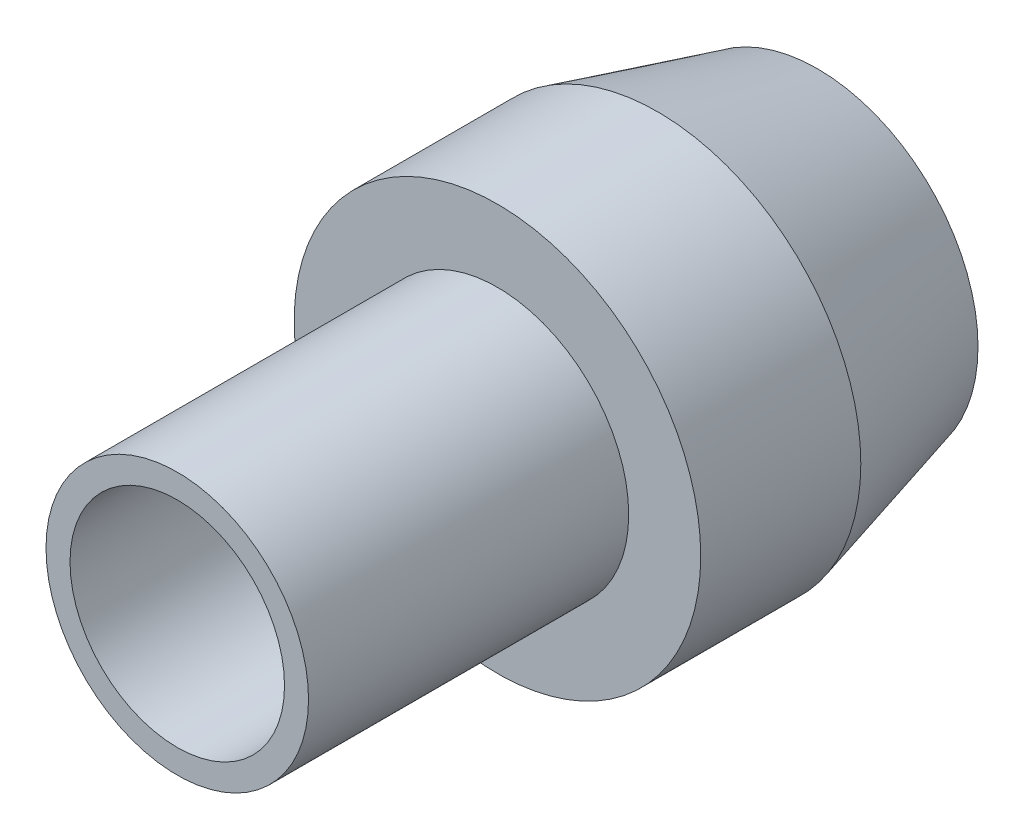
from build123d import *

# Parameters (mm, degrees)
SKETCH1_R           = 12.7
SKETCH1_R_2         = 8.2
SKETCH1_R_3         = 6.7
BOSS_EXTRUDE1_DEPTH = 20
BOSS_EXTRUDE2_START = 20
SKETCH1_4_R         = 8.2
SKETCH1_4_R_2       = 6.7
BOSS_EXTRUDE2_DEPTH = 20
CHAMFER1_SIZE       = 10
CHAMFER1_SIZE2      = 2.679491924


with BuildPart() as part:
    # Sketch1 → Boss-Extrude1 (new body)
    # profile 1 of 2: a face of its own
    with BuildSketch(Plane.XY):
        Circle(SKETCH1_R)
        Circle(SKETCH1_R_2, mode=Mode.SUBTRACT)
    # profile 2 of 2: a face of its own
    with BuildSketch(Plane.XY):
        Circle(SKETCH1_R_2)
        Circle(SKETCH1_R_3, mode=Mode.SUBTRACT)
    extrude(amount=BOSS_EXTRUDE1_DEPTH)

    # Sketch1<4> → Boss-Extrude2 (add)
    with BuildSketch(Plane.XY.offset(BOSS_EXTRUDE2_START)):
        Circle(SKETCH1_4_R)
        Circle(SKETCH1_4_R_2, mode=Mode.SUBTRACT)
    extrude(amount=BOSS_EXTRUDE2_DEPTH)

    # Chamfer1
    chamfer1_edges = [part.edges().sort_by_distance(p)[0] for p in [
        (-12.7, 0, 0),
    ]]
    chamfer1_side = [part.faces().sort_by_distance(p)[0] for p in [
        (-12.7, 0, 10),
    ]]
    chamfer(chamfer1_edges, length=CHAMFER1_SIZE, length2=CHAMFER1_SIZE2, reference=chamfer1_side[0])


solid = part.part
